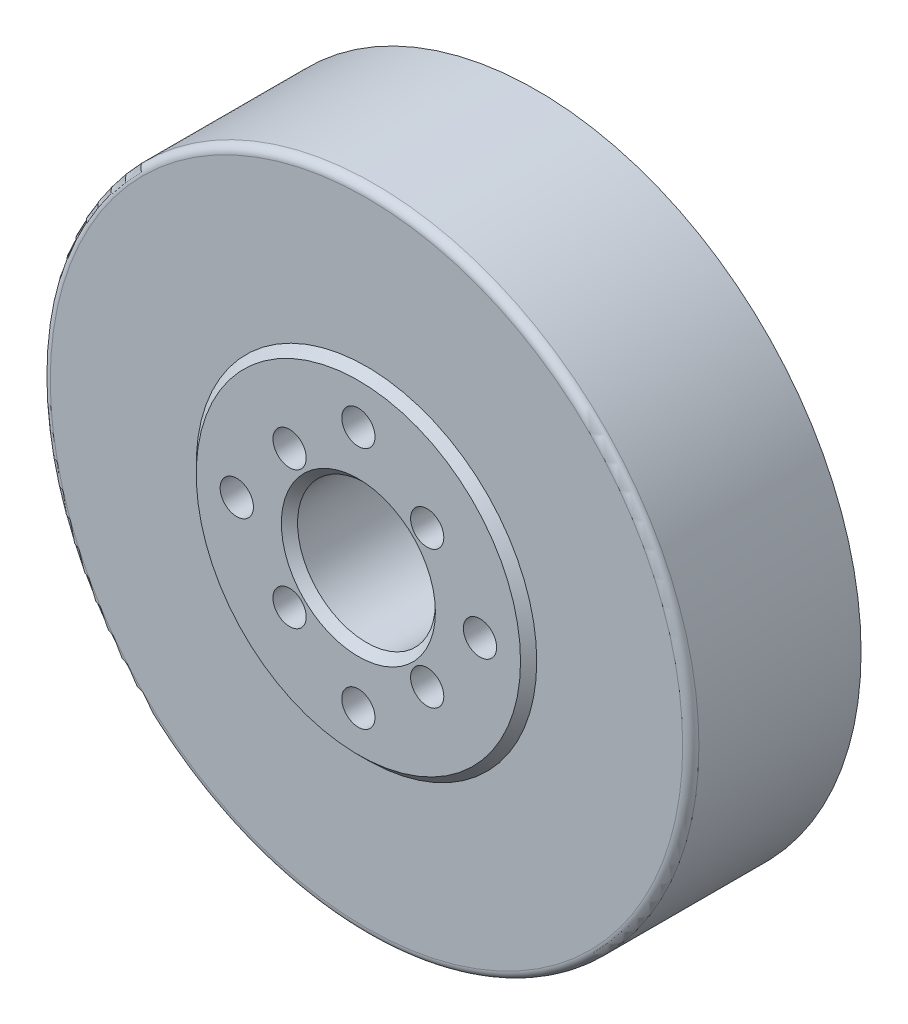
from build123d import *

# Parameters (mm, degrees)
SKETCH1_R                    = 20
BOSS_EXTRUDE1_DEPTH          = 10.5
SKETCH2_R                    = 10.5
SKETCH2_R_2                  = 4.25
BOSS_EXTRUDE3_DEPTH          = 0.5
BOSS_EXTRUDE3_DRAFT          = 45
SKETCH3_R                    = 4.25
CUT_EXTRUDE1_DEPTH           = 10.5
M2_5X0_45_TAPPED_HOLE1_D     = 2.05
M2_5X0_45_TAPPED_HOLE1_DEPTH = 4.384117865
M2_5X0_45_TAPPED_HOLE1_TIP   = 0.615882135
FILLET1_R                    = 0.5


with BuildPart() as part:
    # Sketch1 → Boss-Extrude1 (new body)
    with BuildSketch(Plane(origin=(0, 0, 0), x_dir=(0, 1, 0), z_dir=(0, 0, 1))):
        with Locations(Location((0, 0, 0), (0, 0, 90))):
            Circle(SKETCH1_R)
    extrude(amount=BOSS_EXTRUDE1_DEPTH)


with BuildPart() as boss_extrude3_tool:
    # Sketch2 → Boss-Extrude3 (with draft: the straight prism first)
    with BuildSketch(Plane.XY.offset(10.5)):
        Circle(SKETCH2_R)
        Circle(SKETCH2_R_2, mode=Mode.SUBTRACT)
    extrude(amount=BOSS_EXTRUDE3_DEPTH)
    # Boss-Extrude3: the draft: its side faces are tilted about the plane it starts from
    boss_extrude3_sides = [boss_extrude3_tool.faces().sort_by_distance(p)[0] for p in [
        (-10.5, 0, 10.75),
        (-4.25, 0, 10.75),
    ]]
    draft(boss_extrude3_sides, Plane.XY.offset(10.5), BOSS_EXTRUDE3_DRAFT)


with BuildPart() as part_1:
    add(part.part)

    # Boss-Extrude3: add boss_extrude3_tool
    add(boss_extrude3_tool.part)

    # Sketch3 → Cut-Extrude1 (cut)
    with BuildSketch(Plane.XY.offset(10.5)):
        Circle(SKETCH3_R)
    extrude(amount=-CUT_EXTRUDE1_DEPTH, mode=Mode.SUBTRACT)

    # M2.5x0.45 Tapped Hole1
    with Locations(Plane(origin=(0, 0, 11), x_dir=(0, -1, 0), z_dir=(0, 0, 1))):
        with Locations((4.242640687, -4.242640687), (-7.5, 0), (0, -7.5), (7.5, 0), (0, 7.5), (4.242640687, 4.242640687), (-4.242640687, 4.242640687), (-4.242640687, -4.242640687)):
            Hole(M2_5X0_45_TAPPED_HOLE1_D / 2, depth=M2_5X0_45_TAPPED_HOLE1_DEPTH)
            with Locations((0, 0, -(M2_5X0_45_TAPPED_HOLE1_DEPTH + M2_5X0_45_TAPPED_HOLE1_TIP / 2))):  # 118° drill point
                Cone(0, M2_5X0_45_TAPPED_HOLE1_D / 2, M2_5X0_45_TAPPED_HOLE1_TIP, mode=Mode.SUBTRACT)

    # Fillet1
    fillet1_edges = [part_1.edges().sort_by_distance(p)[0] for p in [
        (20, 0, 10.5),
    ]]
    fillet(fillet1_edges, radius=FILLET1_R)


solid = part_1.part
